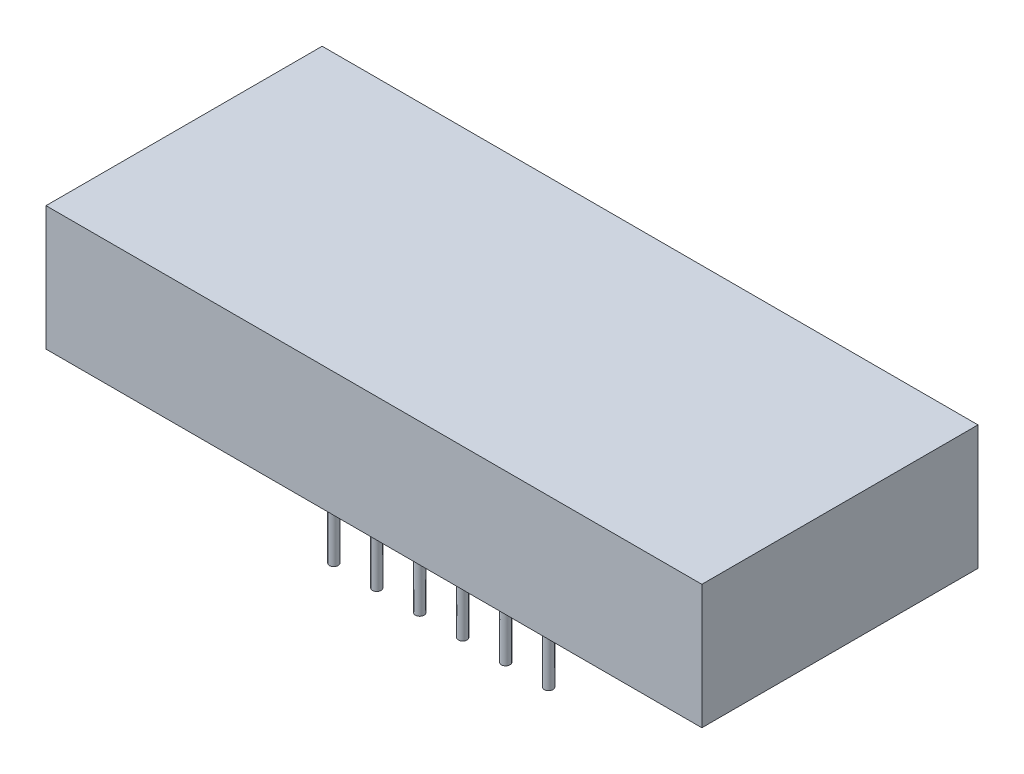
from build123d import *

# Parameters (mm, degrees)
SKETCH_1_W      = 38
SKETCH_1_H      = 16
EXTRUDE_1_DEPTH = 7.2
SKETCH_2_R      = 0.25
EXTRUDE_2_DEPTH = 6.3


with BuildPart() as part:
    # 草图1 → 拉伸1 (new body)
    with BuildSketch(Plane(origin=(0, 0, 0), x_dir=(1, 0, 0), z_dir=(0, 1, 0))):
        Rectangle(SKETCH_1_W, SKETCH_1_H)
    extrude(amount=EXTRUDE_1_DEPTH)

    # 草图2 → 拉伸2 (add)
    with BuildSketch(Plane.XZ):
        with Locations(Location((6.224686657, 4.1, 0), (0, 0, 90))):
            Circle(SKETCH_2_R)
        with Locations(Location((3.734811994, 4.1, 0), (0, 0, 90))):
            Circle(SKETCH_2_R)
        with Locations(Location((1.244937331, 4.1, 0), (0, 0, 90))):
            Circle(SKETCH_2_R)
        with Locations(Location((-1.244937331, 4.1, 0), (0, 0, 90))):
            Circle(SKETCH_2_R)
        with Locations(Location((-3.734811994, 4.1, 0), (0, 0, 90))):
            Circle(SKETCH_2_R)
        with Locations(Location((-6.224686657, 4.1, 0), (0, 0, 90))):
            Circle(SKETCH_2_R)
        with Locations(Location((-6.224686657, -4.1, 0), (0, 0, 90))):
            Circle(SKETCH_2_R)
        with Locations(Location((-3.734811994, -4.1, 0), (0, 0, 90))):
            Circle(SKETCH_2_R)
        with Locations(Location((-1.244937331, -4.1, 0), (0, 0, 90))):
            Circle(SKETCH_2_R)
        with Locations(Location((1.244937331, -4.1, 0), (0, 0, 90))):
            Circle(SKETCH_2_R)
        with Locations(Location((3.734811994, -4.1, 0), (0, 0, 90))):
            Circle(SKETCH_2_R)
        with Locations(Location((6.224686657, -4.1, 0), (0, 0, 90))):
            Circle(SKETCH_2_R)
    extrude(amount=EXTRUDE_2_DEPTH)


solid = part.part
